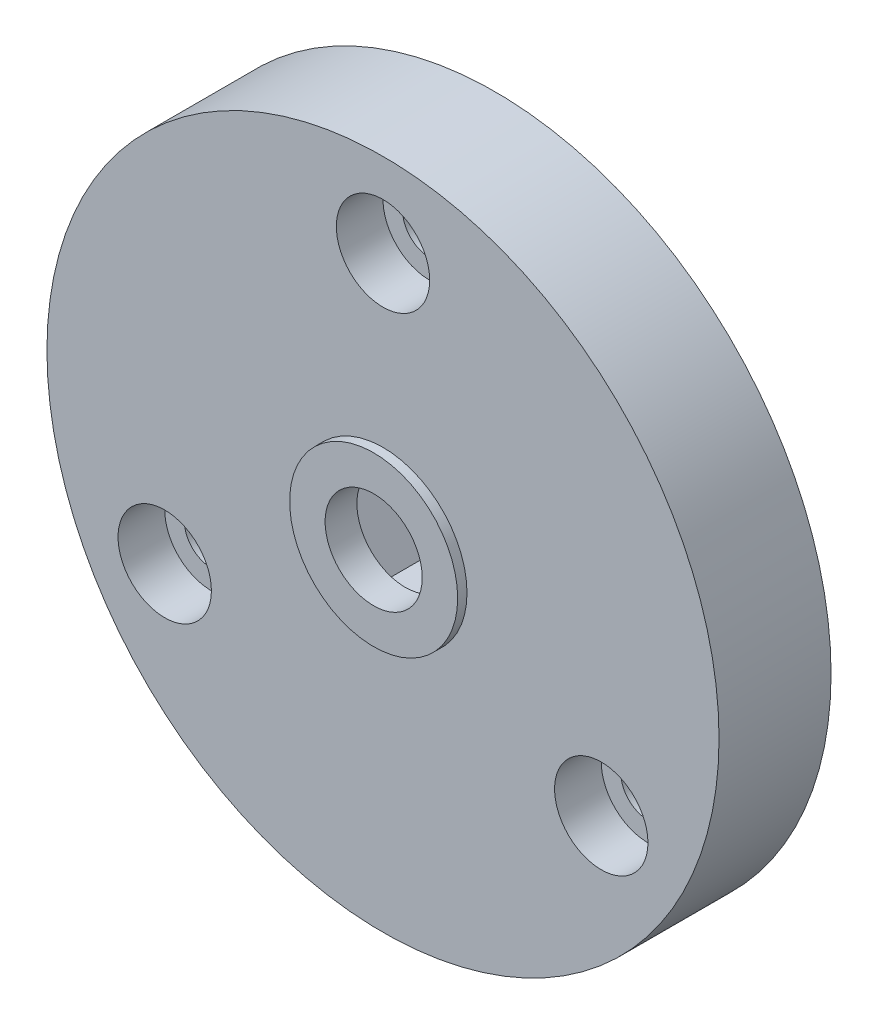
from build123d import *

# Parameters (mm, degrees)
SKETCH1_R           = 18
SKETCH1_R_2         = 2.6
SKETCH1_R_3         = 1.45
BOSS_EXTRUDE1_DEPTH = 6
SKETCH2_R           = 2.5
CUT_EXTRUDE1_DEPTH  = 2.5
SKETCH3_R           = 7.6
CUT_EXTRUDE2_DEPTH  = 1.2
CUT_EXTRUDE3_DEPTH  = 3.6
SKETCH5_R           = 4.5
SKETCH5_R_2         = 2.6
BOSS_EXTRUDE2_DEPTH = 0.5


with BuildPart() as part:
    # Sketch1 → Boss-Extrude1 (new body)
    with BuildSketch(Plane.XY.offset(322)):
        with Locations((300, 300)):
            Circle(SKETCH1_R)
        with Locations((300, 300)):
            Circle(SKETCH1_R_2, mode=Mode.SUBTRACT)
        with Locations((300, 313.5)):
            Circle(SKETCH1_R_3, mode=Mode.SUBTRACT)
        with Locations((288.308657049, 293.25)):
            Circle(SKETCH1_R_3, mode=Mode.SUBTRACT)
        with Locations((311.691342951, 293.25)):
            Circle(SKETCH1_R_3, mode=Mode.SUBTRACT)
    extrude(amount=BOSS_EXTRUDE1_DEPTH)

    # Sketch2 → Cut-Extrude1 (cut)
    with BuildSketch(Plane.XY.offset(325.5)):
        with Locations((300, 313.5)):
            Circle(SKETCH2_R)
        with Locations((288.308657049, 293.25)):
            Circle(SKETCH2_R)
        with Locations((311.691342951, 293.25)):
            Circle(SKETCH2_R)
    extrude(amount=CUT_EXTRUDE1_DEPTH, mode=Mode.SUBTRACT)

    # Sketch3 → Cut-Extrude2 (cut)
    with BuildSketch(Plane.XY.offset(322)):
        with Locations((300, 300)):
            Circle(SKETCH3_R)
    extrude(amount=CUT_EXTRUDE2_DEPTH, mode=Mode.SUBTRACT)

    # Sketch4 → Cut-Extrude3 (cut)
    with BuildSketch(Plane.XY.offset(323.2)):
        Polygon((304.734272207, 300), (302.367136104, 304.1), (297.632863896, 304.1), (295.265727793, 300), (297.632863896, 295.9), (302.367136104, 295.9), align=None)
    extrude(amount=CUT_EXTRUDE3_DEPTH, mode=Mode.SUBTRACT)

    # Sketch5 → Boss-Extrude2 (add)
    with BuildSketch(Plane.XY.offset(328)):
        with Locations((300, 300)):
            Circle(SKETCH5_R)
        with Locations((300, 300)):
            Circle(SKETCH5_R_2, mode=Mode.SUBTRACT)
    extrude(amount=BOSS_EXTRUDE2_DEPTH)


solid = part.part
